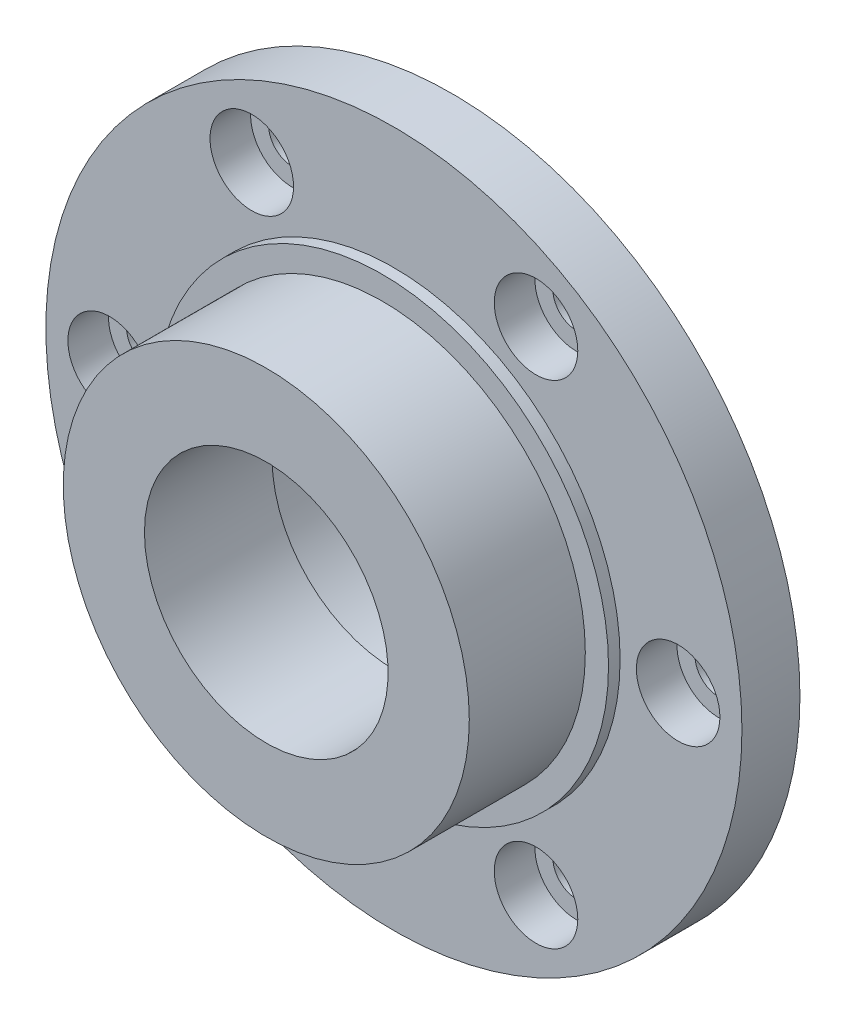
from build123d import *

# Parameters (mm, degrees)
SKETCH1_R           = 30
BOSS_EXTRUDE1_DEPTH = 5
SKETCH2_R           = 19.5
BOSS_EXTRUDE2_DEPTH = 1
SKETCH3_R           = 17.5
BOSS_EXTRUDE3_DEPTH = 10
SKETCH5_R           = 2.05
CUT_EXTRUDE1_DEPTH  = 44.829214002
SKETCH6_R           = 3.6
CUT_EXTRUDE2_DEPTH  = 3.5
SKETCH9_R           = 5.5
CUT_EXTRUDE5_DEPTH  = 4
SKETCH7_R           = 12.025
CUT_EXTRUDE3_DEPTH  = 5
SKETCH8_R           = 10.5
CUT_EXTRUDE4_DEPTH  = 44.829214002


with BuildPart() as part:
    # Sketch1 → Boss-Extrude1 (new body)
    with BuildSketch(Plane.XY):
        Circle(SKETCH1_R)
    extrude(amount=BOSS_EXTRUDE1_DEPTH)

    # Sketch2 → Boss-Extrude2 (add)
    with BuildSketch(Plane.XY.offset(5)):
        Circle(SKETCH2_R)
    extrude(amount=BOSS_EXTRUDE2_DEPTH)

    # Sketch3 → Boss-Extrude3 (add)
    with BuildSketch(Plane.XY.offset(6)):
        Circle(SKETCH3_R)
    extrude(amount=BOSS_EXTRUDE3_DEPTH)

    # Sketch5 → Cut-Extrude1 (cut, through all)
    with BuildSketch(Plane.XY.offset(5)):
        with Locations((24.5, 0)):
            Circle(SKETCH5_R)
        with Locations((12.25, -21.217622393)):
            Circle(SKETCH5_R)
        with Locations((-12.25, -21.217622393)):
            Circle(SKETCH5_R)
        with Locations((-24.5, 0)):
            Circle(SKETCH5_R)
        with Locations((-12.25, 21.217622393)):
            Circle(SKETCH5_R)
        with Locations((12.25, 21.217622393)):
            Circle(SKETCH5_R)
    extrude(amount=-CUT_EXTRUDE1_DEPTH, mode=Mode.SUBTRACT)

    # Sketch6 → Cut-Extrude2 (cut)
    with BuildSketch(Plane.XY.offset(5)):
        with Locations((24.5, 0)):
            Circle(SKETCH6_R)
        with Locations((12.25, -21.217622393)):
            Circle(SKETCH6_R)
        with Locations((-12.25, -21.217622393)):
            Circle(SKETCH6_R)
        with Locations((-24.5, 0)):
            Circle(SKETCH6_R)
        with Locations((-12.25, 21.217622393)):
            Circle(SKETCH6_R)
        with Locations((12.25, 21.217622393)):
            Circle(SKETCH6_R)
    extrude(amount=-CUT_EXTRUDE2_DEPTH, mode=Mode.SUBTRACT)

    # Sketch9 → Cut-Extrude5 (cut)
    with BuildSketch(Plane(origin=(0, 0, 0), x_dir=(-1, 0, 0), z_dir=(0, 0, -1))):
        Circle(SKETCH9_R)
    extrude(amount=-CUT_EXTRUDE5_DEPTH, mode=Mode.SUBTRACT)

    # Sketch7 → Cut-Extrude3 (cut)
    with BuildSketch(Plane(origin=(0, 0, 0), x_dir=(-1, 0, 0), z_dir=(0, 0, -1))):
        Circle(SKETCH7_R)
    extrude(amount=-CUT_EXTRUDE3_DEPTH, mode=Mode.SUBTRACT)

    # Sketch8 → Cut-Extrude4 (cut, through all)
    with BuildSketch(Plane(origin=(0, 0, 5), x_dir=(-1, 0, 0), z_dir=(0, 0, -1))):
        Circle(SKETCH8_R)
    extrude(amount=-CUT_EXTRUDE4_DEPTH, mode=Mode.SUBTRACT)


solid = part.part
